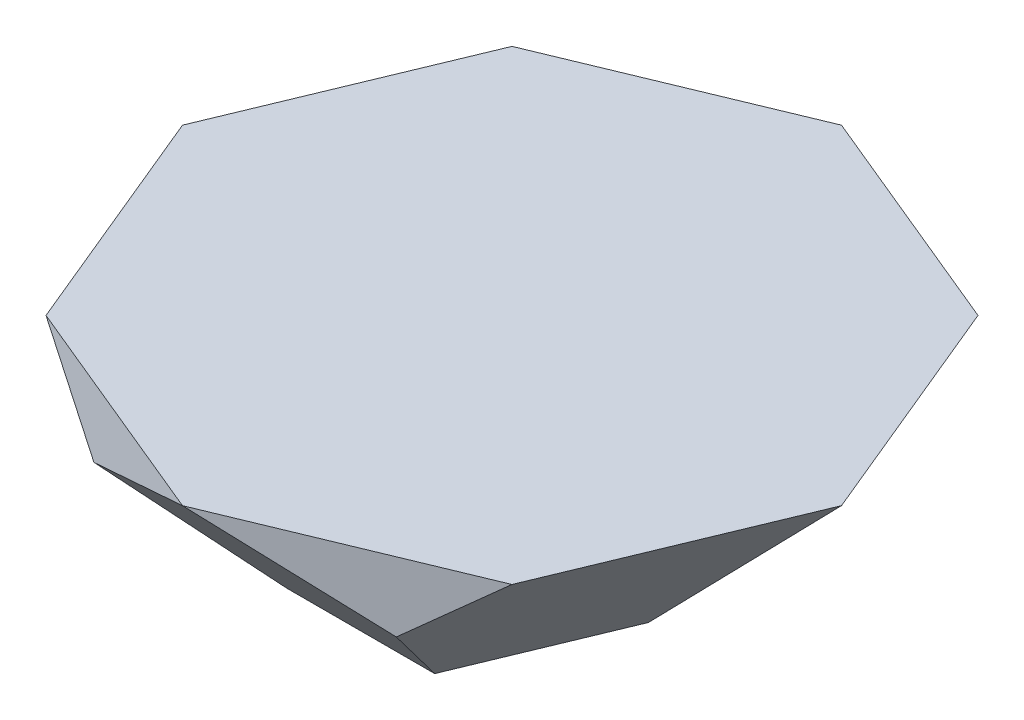
from build123d import *

# Parameters (mm, degrees)
AUFSATZ_LINEAR_AUSTRAGEN1_DEPTH      = 30
SCHNITT_LINEAR_AUSTRAGEN1_DEPTH      = 129.06193767
SCHNITT_LINEAR_AUSTRAGEN2_DEPTH      = 129.06193767
SCHNITT_LINEAR_AUSTRAGEN3_DEPTH      = 77.811457479
SCHNITT_LINEAR_AUSTRAGEN3_DEPTH_BACK = 77.811457479


with BuildPart() as part:
    # Skizze1 → Aufsatz-Linear austragen1 (new body)
    with BuildSketch(Plane(origin=(0, 0, 0), x_dir=(1, 0, 0), z_dir=(0, 1, 0))):
        Polygon((35.355339059, -35.355339059), (50, 0), (35.355339059, 35.355339059), (0, 50), (-35.355339059, 35.355339059), (-50, 0), (-35.355339059, -35.355339059), (0, -50), align=None)
    extrude(amount=AUFSATZ_LINEAR_AUSTRAGEN1_DEPTH)

    # Skizze2 → Schnitt-Linear austragen1 (cut, through all)
    with BuildSketch(Plane(origin=(21.504503853, 0, 51.916464855), x_dir=(0.9238795325112895, 0, -0.3826834323650833), z_dir=(0.3826834323650833, 0, 0.9238795325112895))):
        Polygon((-46.193976626, 30), (-19.134171618, 0), (-46.193976626, 0), align=None)
        Polygon((46.193976626, 30), (46.193976626, 0), (19.134171618, 0), align=None)
    extrude(amount=-SCHNITT_LINEAR_AUSTRAGEN1_DEPTH, mode=Mode.SUBTRACT)

    # Skizze3 → Schnitt-Linear austragen2 (cut, through all)
    with BuildSketch(Plane(origin=(-21.504503853, 0, 51.916464855), x_dir=(0.9238795325112874, 0, 0.38268343236508817), z_dir=(-0.38268343236508817, 0, 0.9238795325112874))):
        Polygon((19.134171618, 0), (46.193976626, 30), (46.193976626, 0), align=None)
        Polygon((-46.193976626, 30), (-46.193976626, 0), (-19.133976626, 0), align=None)
    extrude(amount=-SCHNITT_LINEAR_AUSTRAGEN2_DEPTH, mode=Mode.SUBTRACT)

    # Skizze4 → Schnitt-Linear austragen3 (cut, two sides: drawn at the far end of the back side and taken through both)
    with BuildSketch(Plane(origin=(0, 0, 0), x_dir=(0, 0, -1), z_dir=(1, 0, 0)).offset(-SCHNITT_LINEAR_AUSTRAGEN3_DEPTH_BACK)):
        Polygon((-50, 30), (-50, 0), (-22.94, 0), align=None)
        Polygon((22.93974523, 0), (49.99974523, 0), (50, 30), align=None)
    extrude(amount=SCHNITT_LINEAR_AUSTRAGEN3_DEPTH + SCHNITT_LINEAR_AUSTRAGEN3_DEPTH_BACK, mode=Mode.SUBTRACT)


with BuildPart() as schnitt_linear_austragen3_piece_1:
    # of the separate pieces the step leaves, piece 1, a body of its own (schnitt_linear_austragen3_pieces)
    add(part.part.solids().sort_by_distance((35.355339059, 30, 35.355339059))[0])


with BuildPart() as schnitt_linear_austragen3_piece_2:
    # of the separate pieces the step leaves, piece 2, a body of its own (schnitt_linear_austragen3_pieces)
    add(part.part.solids().sort_by_distance((0.000105529, 8.9544e-05, -49.999956288))[0])


solid = Compound([schnitt_linear_austragen3_piece_1.part, schnitt_linear_austragen3_piece_2.part])
